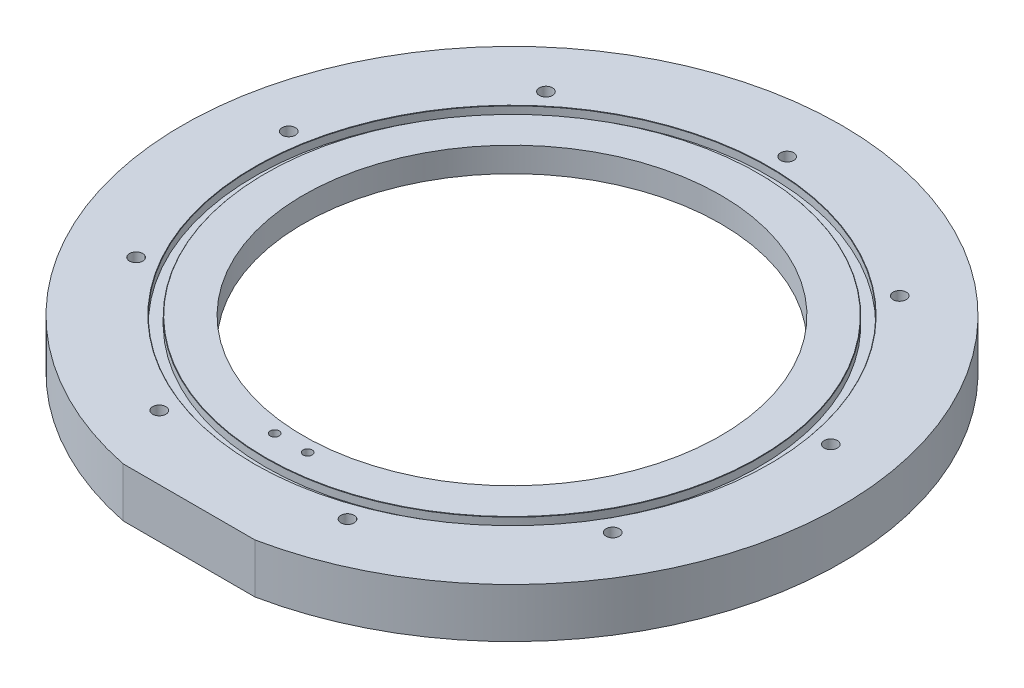
from build123d import *

# Parameters (mm, degrees)
F_1_4_20_TAPPED_HOLE1_D     = 5.1054
F_1_4_20_TAPPED_HOLE1_DEPTH = 13.335
F_1_4_20_TAPPED_HOLE1_TIP   = 1.533816902
SKETCH4_W                   = 4.064
SKETCH4_H                   = 3.0734
CHAMFER1_SIZE               = 0.127
F_8_32_TAPPED_HOLE1_D       = 3.4544
CUT_EXTRUDE1_REACH          = 182.613
SKETCH7_W                   = 50.8
SKETCH7_H                   = 2.565921067


with BuildPart() as part:
    # Sketch1 → Revolve1 (revolve)
    with BuildSketch(Plane.XY, mode=Mode.PRIVATE) as revolve1_sk:
        Polygon((109.7915, 0), (109.7915, 2.54), (105.7783, 2.54), (99.4283, 2.54), (99.4283, 9.525), (80.3783, 9.525), (80.3783, 19.05), (105.7783, 19.05), (127, 19.05), (127, 0), align=None)
    revolve(revolve1_sk.sketch.rotate(Axis((0, 0, 0), (0, 1, 0)), 90), axis=Axis((0, 0, 0), (0, 1, 0)))

    # 1/4-20 Tapped Hole1
    with Locations(Plane(origin=(0, 19.05, 0), x_dir=(1, 0, 0), z_dir=(0, 1, 0))):
        with Locations((0, 106.045), (68.164412069, 81.235182971), (104.433938168, 18.414521001), (91.837663944, -53.0225), (36.269526099, -99.649703971), (-36.269526099, -99.649703971), (-91.837663944, -53.0225), (-104.433938168, 18.414521001), (-68.164412069, 81.235182971)):
            Hole(F_1_4_20_TAPPED_HOLE1_D / 2, depth=F_1_4_20_TAPPED_HOLE1_DEPTH)
            with Locations((0, 0, -(F_1_4_20_TAPPED_HOLE1_DEPTH + F_1_4_20_TAPPED_HOLE1_TIP / 2))):  # 118° drill point
                Cone(0, F_1_4_20_TAPPED_HOLE1_D / 2, F_1_4_20_TAPPED_HOLE1_TIP, mode=Mode.SUBTRACT)

    # Sketch4 → Cut-Revolve1 (revolve, cut)
    with BuildSketch(Plane.XY, mode=Mode.PRIVATE) as cut_revolve1_sk:
        with Locations((97.0788, 17.5133)):
            Rectangle(SKETCH4_W, SKETCH4_H)
    revolve(cut_revolve1_sk.sketch.rotate(Axis((0, 19.05, 0), (0, -1, 0)), 90), axis=Axis((0, 19.05, 0), (0, -1, 0)), mode=Mode.SUBTRACT)

    # Chamfer1
    chamfer1_edges = [part.edges().sort_by_distance(p)[0] for p in [
        (0, 19.05, -95.0468),
        (0, 19.05, -99.1108),
    ]]
    chamfer(chamfer1_edges, length=CHAMFER1_SIZE)

    # #8-32 Tapped Hole1 (through all)
    with Locations(Plane(origin=(0, 9.525, 0), x_dir=(-1, 0, 0), z_dir=(0, -1, 0))):
        with Locations((6.35, -85.09), (-6.35, -85.09)):
            Hole(F_8_32_TAPPED_HOLE1_D / 2)

    # Sketch7 → Cut-Extrude1 (cut, up to next)
    with BuildSketch(Plane(origin=(0, 19.05, 0), x_dir=(1, 0, 0), z_dir=(0, 1, 0)), mode=Mode.PRIVATE) as cut_extrude1_sk1:
        with Locations((0, -125.717039467)):
            Rectangle(SKETCH7_W, SKETCH7_H)
    cut_extrude1_tool1 = extrude(cut_extrude1_sk1.sketch, amount=-CUT_EXTRUDE1_REACH, mode=Mode.PRIVATE) & part.part
    add(cut_extrude1_tool1.solids().sort_by_distance((0, 19.05, 125.717039))[0], mode=Mode.SUBTRACT)


solid = part.part
